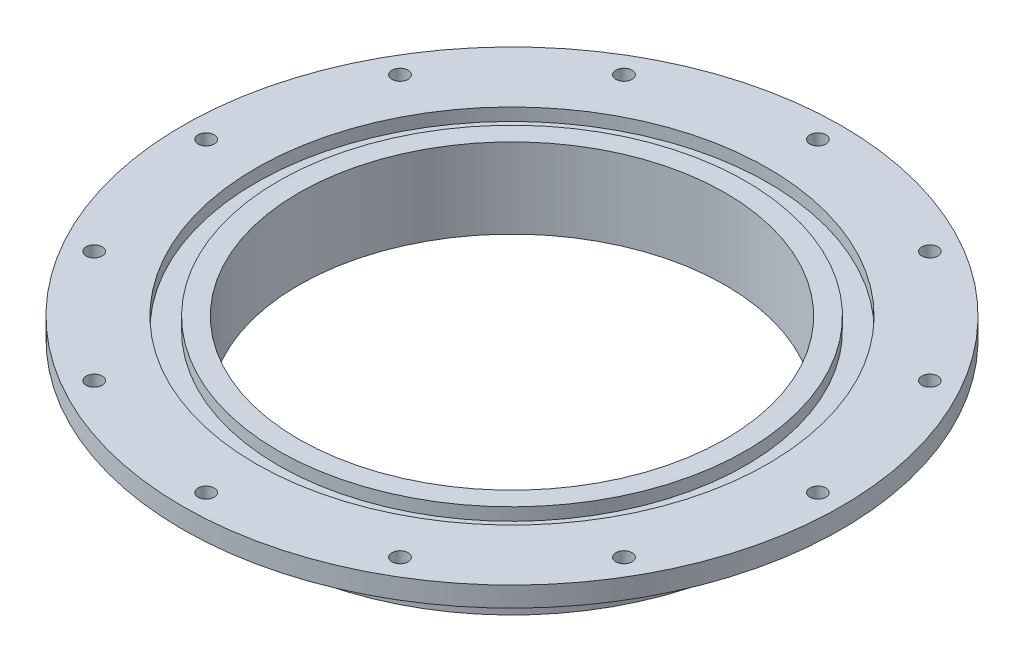
from build123d import *

# Parameters (mm, degrees)
SKETCH1_R            = 80.518
SKETCH1_R_2          = 67.818
INNER_CYLINDER_DEPTH = 19.05
SKETCH2_R            = 104.775
SKETCH2_R_2          = 67.818
FLANGE_DEPTH         = 6.35
SKETCH4_R            = 81.407
SKETCH4_R_2          = 74.295
GROOVE_DEPTH         = 3.9878
SKETCH5_R            = 2.5527
SCREW_HOLES_DEPTH    = 6.35
CIRPATTERN1_COUNT    = 12


with BuildPart() as part:
    # Sketch1 → Inner Cylinder (new body)
    with BuildSketch(Plane(origin=(0, 0, 0), x_dir=(1, 0, 0), z_dir=(0, 1, 0))):
        with Locations(Location((0, 0, 0), (0, 0, 90))):
            Circle(SKETCH1_R)
        with Locations(Location((0, 0, 0), (0, 0, 90))):
            Circle(SKETCH1_R_2, mode=Mode.SUBTRACT)
    extrude(amount=INNER_CYLINDER_DEPTH)

    # Sketch2 → Flange (add)
    with BuildSketch(Plane(origin=(0, 19.05, 0), x_dir=(1, 0, 0), z_dir=(0, 1, 0))):
        with Locations(Location((0, 0, 0), (0, 0, 270))):
            Circle(SKETCH2_R)
        with Locations(Location((0, 0, 0), (0, 0, 90))):
            Circle(SKETCH2_R_2, mode=Mode.SUBTRACT)
    extrude(amount=FLANGE_DEPTH)

    # Sketch4 → Groove (cut)
    with BuildSketch(Plane(origin=(0, 25.4, 0), x_dir=(1, 0, 0), z_dir=(0, 1, 0))):
        with Locations(Location((0, 0, 0), (0, 0, 270))):
            Circle(SKETCH4_R)
        with Locations(Location((0, 0, 0), (0, 0, 270))):
            Circle(SKETCH4_R_2, mode=Mode.SUBTRACT)
    extrude(amount=-GROOVE_DEPTH, mode=Mode.SUBTRACT)

    # Sketch5 → Screw Holes (cut)
    with BuildSketch(Plane(origin=(0, 25.4, 0), x_dir=(1, 0, 0), z_dir=(0, 1, 0))):
        with Locations(Location((0, -97.25025, 0), (0, 0, 270))):
            Circle(SKETCH5_R)
    screw_holes = extrude(amount=-SCREW_HOLES_DEPTH, mode=Mode.SUBTRACT)

    # CirPattern1: Screw Holes ×12 about axis
    cirpattern1_axis = Axis((0, 0, 0), (0, 1, 0))
    for i in range(1, CIRPATTERN1_COUNT):
        add(screw_holes.rotate(cirpattern1_axis, i * 360 / CIRPATTERN1_COUNT), mode=Mode.SUBTRACT)


solid = part.part
